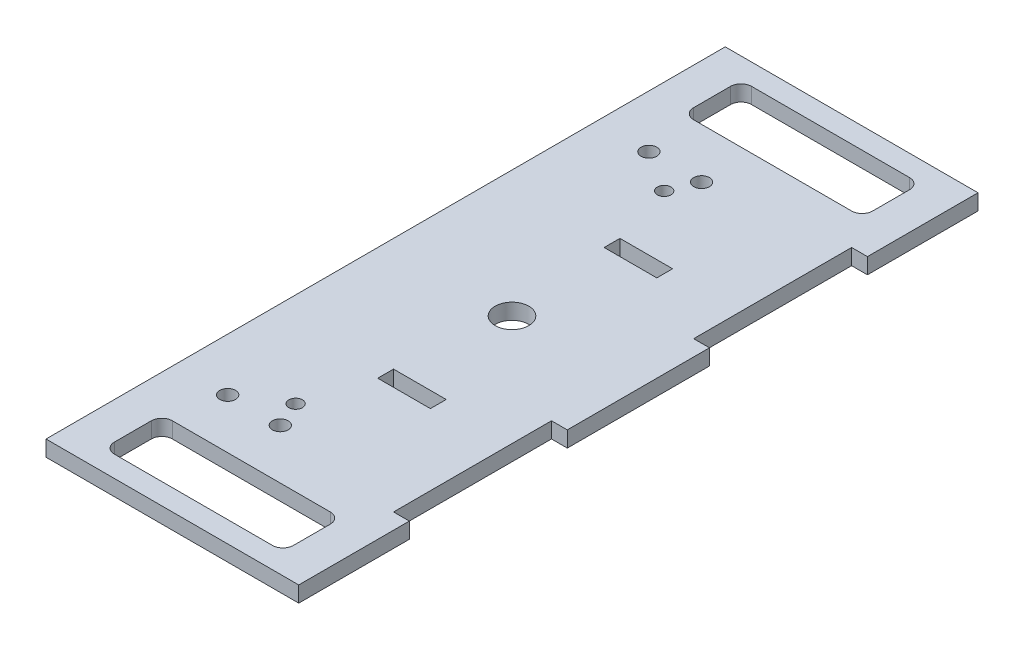
from build123d import *

# Parameters (mm, degrees)
SKETCH1_W            = 48
SKETCH1_H            = 213
SKETCH1_R            = 3.2
BOSS_EXTRUDE1_DEPTH  = 3
SKETCH2_W            = 3
SKETCH2_H            = 21
SKETCH2_H_2          = 30
CUT_EXTRUDE1_DEPTH   = 110.211949896
SKETCH3_W            = 10
SKETCH3_H            = 3
CUT_EXTRUDE2_DEPTH   = 110.211949896
SKETCH4_R            = 1.3
CUT_EXTRUDE3_DEPTH   = 110.211949896
SKETCH5_W            = 48
SKETCH5_H            = 42
CUT_EXTRUDE4_DEPTH   = 110.211949896
SKETCH6_W            = 34
SKETCH6_H            = 11
CUT_EXTRUDE5_DEPTH   = 69.885775019
FILLET1_R            = 2
FILLET1_OF_MIRROR1_R = 2
SKETCH7_R            = 1.5
CUT_EXTRUDE6_DEPTH   = 69.885775019


with BuildPart() as part:
    # Sketch1 → Boss-Extrude1 (new body)
    with BuildSketch(Plane(origin=(0, 0, 0), x_dir=(1, 0, 0), z_dir=(0, 1, 0))):
        Rectangle(SKETCH1_W, SKETCH1_H)
        with Locations(Location((0, 0, 0), (0, 0, 270))):
            Circle(SKETCH1_R, mode=Mode.SUBTRACT)
    extrude(amount=BOSS_EXTRUDE1_DEPTH)

    # Sketch2 → Cut-Extrude1 (cut, through all)
    with BuildSketch(Plane(origin=(0, 3, 0), x_dir=(1, 0, 0), z_dir=(0, 1, 0))):
        with Locations((22.5, 75)):
            Rectangle(SKETCH2_W, SKETCH2_H)
        with Locations((22.5, 28.5)):
            Rectangle(SKETCH2_W, SKETCH2_H_2)
        with Locations((22.5, -28.5)):
            Rectangle(SKETCH2_W, SKETCH2_H_2)
        with Locations((22.5, -75)):
            Rectangle(SKETCH2_W, SKETCH2_H)
    extrude(amount=-CUT_EXTRUDE1_DEPTH, mode=Mode.SUBTRACT)

    # Sketch3 → Cut-Extrude2 (cut, through all)
    with BuildSketch(Plane(origin=(0, 3, 0), x_dir=(1, 0, 0), z_dir=(0, 1, 0))):
        with Locations((2.5, -21.5)):
            Rectangle(SKETCH3_W, SKETCH3_H)
        with Locations((2.5, 21.5)):
            Rectangle(SKETCH3_W, SKETCH3_H)
    extrude(amount=-CUT_EXTRUDE2_DEPTH, mode=Mode.SUBTRACT)

    # Sketch4 → Cut-Extrude3 (cut, through all)
    with BuildSketch(Plane(origin=(0, 3, 0), x_dir=(1, 0, 0), z_dir=(0, 1, 0))):
        with Locations(Location((-6.1, -35, 0), (0, 0, 270))):
            Circle(SKETCH4_R)
        with Locations(Location((-6.1, 35, 0), (0, 0, 90))):
            Circle(SKETCH4_R)
    extrude(amount=-CUT_EXTRUDE3_DEPTH, mode=Mode.SUBTRACT)

    # Sketch5 → Cut-Extrude4 (cut, through all)
    with BuildSketch(Plane(origin=(0, 3, 0), x_dir=(1, 0, 0), z_dir=(0, 1, 0))):
        with Locations((0, 85.5)):
            Rectangle(SKETCH5_W, SKETCH5_H)
        with Locations((0, -85.5)):
            Rectangle(SKETCH5_W, SKETCH5_H)
    extrude(amount=-CUT_EXTRUDE4_DEPTH, mode=Mode.SUBTRACT)

    # Sketch6 → Cut-Extrude5 (cut, through all)
    with BuildSketch(Plane(origin=(0, 3, 0), x_dir=(1, 0, 0), z_dir=(0, 1, 0))):
        with Locations((0, 55)):
            Rectangle(SKETCH6_W, SKETCH6_H)
    cut_extrude5 = extrude(amount=-CUT_EXTRUDE5_DEPTH, mode=Mode.SUBTRACT)

    # Fillet1
    fillet1_edges = [part.edges().sort_by_distance(p)[0] for p in [
        (-17, 1.5, -49.5),
        (-17, 1.5, -60.5),
        (17, 1.5, -60.5),
        (17, 1.5, -49.5),
    ]]
    fillet(fillet1_edges, radius=FILLET1_R)

    # Mirror1: Cut-Extrude5 across plane
    add(cut_extrude5.mirror(Plane.XY), mode=Mode.SUBTRACT)

    # Fillet1 of Mirror1
    fillet1_of_mirror1_edges = [part.edges().sort_by_distance(p)[0] for p in [
        (-17, 1.5, 49.5),
        (-17, 1.5, 60.5),
        (17, 1.5, 60.5),
        (17, 1.5, 49.5),
    ]]
    fillet(fillet1_of_mirror1_edges, radius=FILLET1_OF_MIRROR1_R)

    # Sketch7 → Cut-Extrude6 (cut, through all)
    with BuildSketch(Plane(origin=(0, 3, 0), x_dir=(1, 0, 0), z_dir=(0, 1, 0))):
        with Locations(Location((-14, -40, 0), (0, 0, 270))):
            Circle(SKETCH7_R)
        with Locations(Location((-4, -40, 0), (0, 0, 270))):
            Circle(SKETCH7_R)
    cut_extrude6 = extrude(amount=-CUT_EXTRUDE6_DEPTH, mode=Mode.SUBTRACT)

    # Mirror2: Cut-Extrude6 across plane
    add(cut_extrude6.mirror(Plane.XY), mode=Mode.SUBTRACT)


solid = part.part
